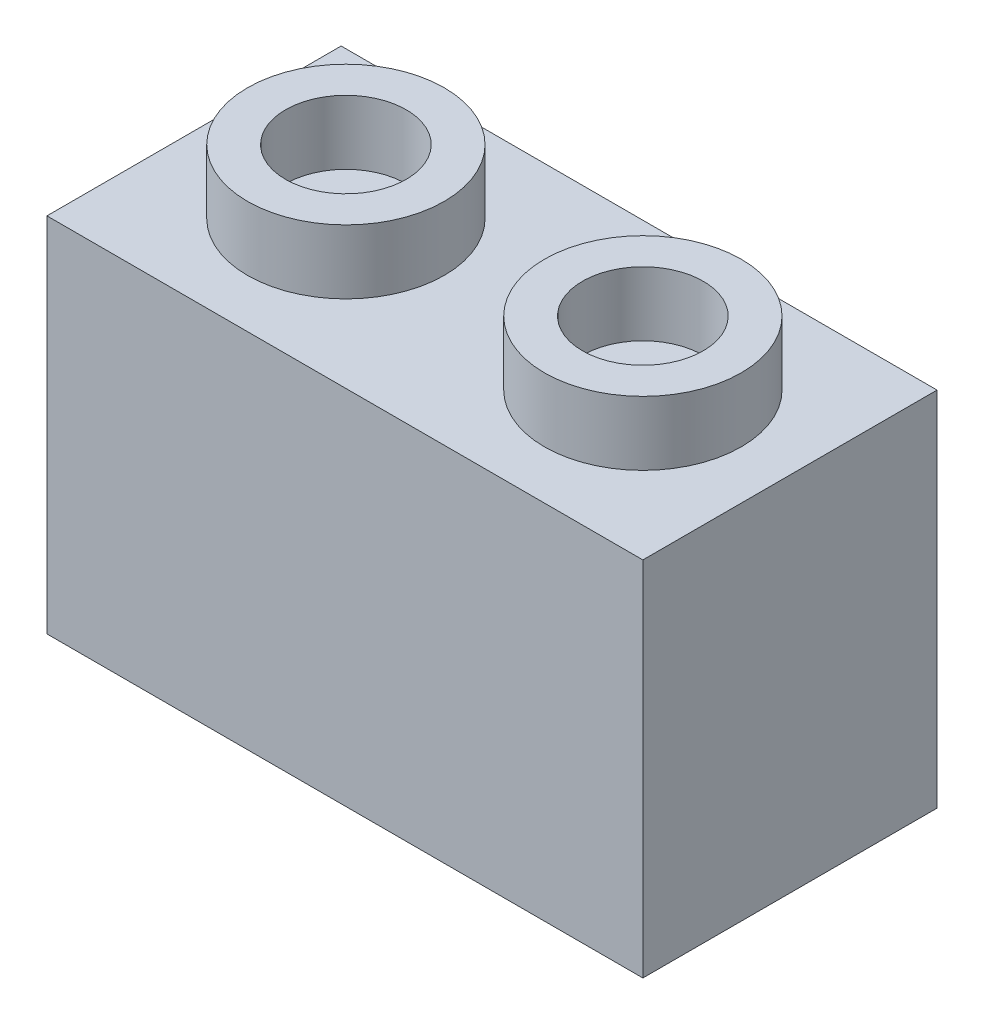
from build123d import *

# Parameters (mm, degrees)
SKETCH_2_W          = 15.8
SKETCH_2_H          = 7.8
EXTRUDE_1_DEPTH     = 9.6
SKETCH_3_R          = 2.609387956
EXTRUDE_2_DEPTH     = 1.7
SKETCH_4_R          = 1.6
CUT_EXTRUDE_1_DEPTH = 1.7
SKETCH_5_R          = 1.6
CUT_EXTRUDE_2_DEPTH = 1.7


with BuildPart() as part:
    # Эскиз2 → Бобышка-Вытянуть1 (new body)
    with BuildSketch(Plane(origin=(0, 0, 0), x_dir=(1, 0, 0), z_dir=(0, 1, 0))):
        Rectangle(SKETCH_2_W, SKETCH_2_H)
    extrude(amount=EXTRUDE_1_DEPTH)

    # Эскиз3 → Бобышка-Вытянуть2 (add)
    with BuildSketch(Plane(origin=(0, 9.6, 0), x_dir=(1, 0, 0), z_dir=(0, 1, 0))):
        with Locations(Location((4, 0, 0), (0, 0, 270))):
            Circle(SKETCH_3_R)
        with Locations(Location((-3.874, 0, 0), (0, 0, 270))):
            Circle(SKETCH_3_R)
    extrude(amount=EXTRUDE_2_DEPTH)

    # Эскиз4 → Вырез-Вытянуть1 (cut)
    with BuildSketch(Plane(origin=(0, 11.3, 0), x_dir=(1, 0, 0), z_dir=(0, 1, 0))):
        with Locations(Location((-3.874, 0, 0), (0, 0, 270))):
            Circle(SKETCH_4_R)
    extrude(amount=-CUT_EXTRUDE_1_DEPTH, mode=Mode.SUBTRACT)

    # Эскиз5 → Вырез-Вытянуть2 (cut)
    with BuildSketch(Plane(origin=(0, 11.3, 0), x_dir=(1, 0, 0), z_dir=(0, 1, 0))):
        with Locations(Location((4, 0, 0), (0, 0, 270))):
            Circle(SKETCH_5_R)
    extrude(amount=-CUT_EXTRUDE_2_DEPTH, mode=Mode.SUBTRACT)


solid = part.part
